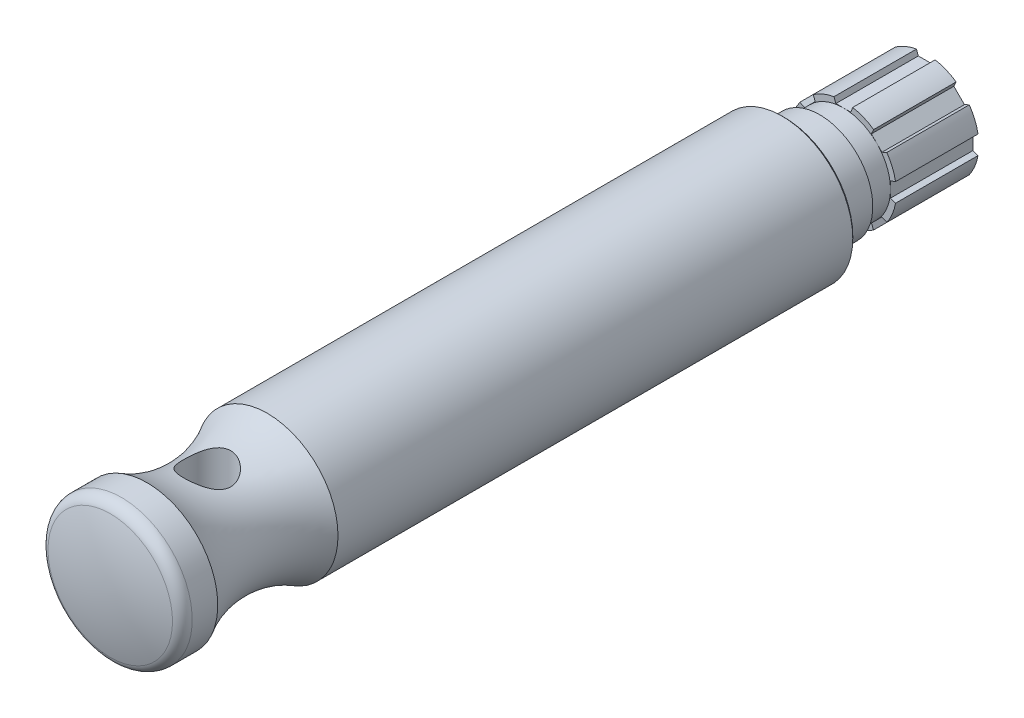
from build123d import *

# Parameters (mm, degrees)
SKETCH1_R                 = 3
BOSS_EXTRUDE1_DEPTH       = 34.5
SKETCH2_R                 = 5
SKETCH3_R                 = 1
CUT_EXTRUDE1_DEPTH        = 3
DOME1_FACE_RADIUS         = 3
DOME1_HEIGHT              = 0.5
CUT_EXTRUDE2_DEPTH        = 3.5
CIRPATTERN1_COUNT         = 8
FILLET1_R                 = 0.5
CHAMFER1_SIZE             = 0.1
M3X0_5_TAPPED_HOLE1_D     = 2.5
M3X0_5_TAPPED_HOLE1_DEPTH = 6
M3X0_5_TAPPED_HOLE1_TIP   = 0.751075774


with BuildPart() as part:
    # Sketch1 → Boss-Extrude1 (new body)
    with BuildSketch(Plane.XY):
        Circle(SKETCH1_R)
    extrude(amount=-BOSS_EXTRUDE1_DEPTH)

    # Sketch2 → Cut-Revolve1 (revolve, cut)
    with BuildSketch(Plane(origin=(0, 0, 0), x_dir=(0, 0, -1), z_dir=(1, 0, 0)), mode=Mode.PRIVATE) as cut_revolve1_sk:
        with Locations((4, 7.3)):
            Circle(SKETCH2_R)
        Polygon((30, 2.25), (30, 2), (31, 2), (31, 2.25), (34.5, 2.25), (34.5, 3), (28.5, 3), (28.5, 2.25), align=None)
    revolve(cut_revolve1_sk.sketch.rotate(Axis((0, 0, -34.5), (0, 0, 1)), 90), axis=Axis((0, 0, -34.5), (0, 0, 1)), mode=Mode.SUBTRACT)

    # Sketch3 → Cut-Extrude1 (cut, symmetric)
    with BuildSketch(Plane(origin=(0, 0, 0), x_dir=(1, 0, 0), z_dir=(0, 1, 0))):
        with Locations(Location((0, 4, 0), (0, 0, 139.808309089))):
            Circle(SKETCH3_R)
    extrude(amount=CUT_EXTRUDE1_DEPTH, both=True, mode=Mode.SUBTRACT)

    # Dome1: a dome of height H over a round flat face of radius A is a cap of a sphere of radius (A * A + H * H) / (2 * H)
    dome1_r = (DOME1_FACE_RADIUS * DOME1_FACE_RADIUS + DOME1_HEIGHT * DOME1_HEIGHT) / (2 * DOME1_HEIGHT)
    dome1_base = Plane((0, 0, 0), z_dir=(0, 0, 1))
    with Locations(dome1_base.offset(DOME1_HEIGHT - dome1_r)):
        dome1_ball = Sphere(dome1_r, mode=Mode.PRIVATE)
    add(split(dome1_ball, bisect_by=dome1_base, keep=Keep.TOP, mode=Mode.PRIVATE))

    # Sketch4 → Cut-Extrude2 (cut)
    with BuildSketch(Plane(origin=(0, 0, -34.5), x_dir=(-1, 0, 0), z_dir=(0, 0, -1))):
        Polygon((-0.5, 2.5), (-0.318014883, 2), (0.318014883, 2), (0.5, 2.5), align=None)
    cut_extrude2 = extrude(amount=-CUT_EXTRUDE2_DEPTH, mode=Mode.SUBTRACT)

    # CirPattern1: Cut-Extrude2 ×8 about axis
    cirpattern1_axis = Axis((0, 0, 0), (0, 0, 1))
    for i in range(1, CIRPATTERN1_COUNT):
        add(cut_extrude2.rotate(cirpattern1_axis, i * 360 / CIRPATTERN1_COUNT), mode=Mode.SUBTRACT)

    # Fillet1
    fillet1_edges = [part.edges().sort_by_distance(p)[0] for p in [
        (-3, 0, 0),
    ]]
    fillet(fillet1_edges, radius=FILLET1_R)

    # Chamfer1
    chamfer1_edges = [part.edges().sort_by_distance(p)[0] for p in [
        (-3, 0, -28.5),
    ]]
    chamfer(chamfer1_edges, length=CHAMFER1_SIZE)

    # M3x0.5 Tapped Hole1
    with Locations(Plane(origin=(0, 0, -34.5), x_dir=(-1, 0, 0), z_dir=(0, 0, -1))):
        with Locations((0, 0)):
            Hole(M3X0_5_TAPPED_HOLE1_D / 2, depth=M3X0_5_TAPPED_HOLE1_DEPTH)
            with Locations((0, 0, -(M3X0_5_TAPPED_HOLE1_DEPTH + M3X0_5_TAPPED_HOLE1_TIP / 2))):  # 118° drill point
                Cone(0, M3X0_5_TAPPED_HOLE1_D / 2, M3X0_5_TAPPED_HOLE1_TIP, mode=Mode.SUBTRACT)


solid = part.part
